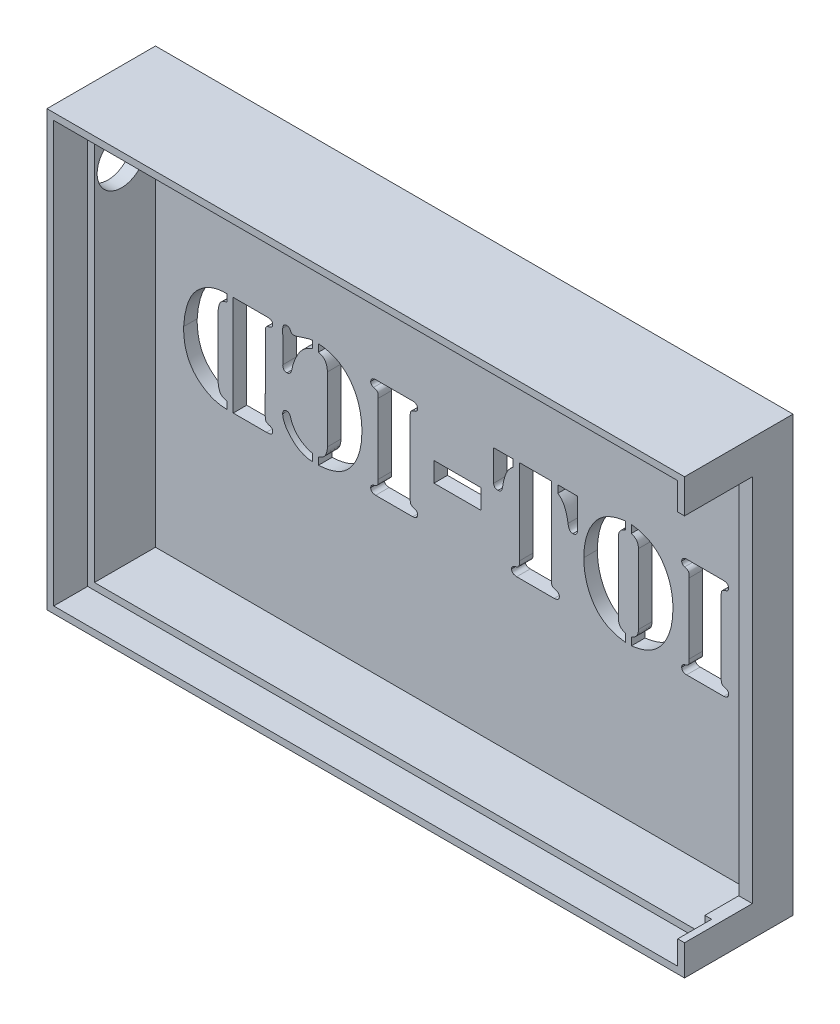
from build123d import *

# Parameters (mm, degrees)
SKETCH1_W           = 94
SKETCH1_H           = 64
BOSS_EXTRUDE1_DEPTH = 16
SKETCH2_W           = 90
SKETCH2_H           = 60
CUT_EXTRUDE1_DEPTH  = 14
SKETCH4_W           = 92
SKETCH4_H           = 62
CUT_EXTRUDE2_DEPTH  = 5
CUT_EXTRUDE4_REACH  = 100.712
SKETCH8_W           = 10
SKETCH8_H           = 54.5
CUT_EXTRUDE3_REACH  = 102.578
SKETCH5_R           = 3.6
CUT_EXTRUDE5_REACH  = 61.068
SKETCH9_W           = 6.905440825
SKETCH9_H           = 2.900056573


with BuildPart() as part:
    # Sketch1 → Boss-Extrude1 (new body)
    with BuildSketch(Plane.XY):
        Rectangle(SKETCH1_W, SKETCH1_H)
    extrude(amount=BOSS_EXTRUDE1_DEPTH)

    # Sketch2 → Cut-Extrude1 (cut)
    with BuildSketch(Plane.XY.offset(16)):
        Rectangle(SKETCH2_W, SKETCH2_H)
    extrude(amount=-CUT_EXTRUDE1_DEPTH, mode=Mode.SUBTRACT)

    # Sketch4 → Cut-Extrude2 (cut)
    with BuildSketch(Plane.XY.offset(16)):
        Rectangle(SKETCH4_W, SKETCH4_H)
    extrude(amount=-CUT_EXTRUDE2_DEPTH, mode=Mode.SUBTRACT)

    # Sketch8 → Cut-Extrude4 (cut, up to next)
    with BuildSketch(Plane.ZY.offset(-45), mode=Mode.PRIVATE) as cut_extrude4_sk1:
        with Locations((11, -0.25)):
            Rectangle(SKETCH8_W, SKETCH8_H)
    cut_extrude4_tool1 = extrude(cut_extrude4_sk1.sketch, amount=-CUT_EXTRUDE4_REACH, mode=Mode.PRIVATE) & part.part
    add(cut_extrude4_tool1.solids().sort_by_distance((45, -0.25, 11))[0], mode=Mode.SUBTRACT)

    # Sketch5 → Cut-Extrude3 (cut, up to next)
    with BuildSketch(Plane.ZY.offset(47), mode=Mode.PRIVATE) as cut_extrude3_sk1:
        with Locations(Location((7, 22, 0), (0, 0, 270))):
            Circle(SKETCH5_R)
    cut_extrude3_tool1 = extrude(cut_extrude3_sk1.sketch, amount=-CUT_EXTRUDE3_REACH, mode=Mode.PRIVATE) & part.part
    add(cut_extrude3_tool1.solids().sort_by_distance((-47, 22, 7))[0], mode=Mode.SUBTRACT)

    # Sketch9 → Cut-Extrude5 (cut, up to next)
    with BuildSketch(Plane(origin=(0, 0, 0), x_dir=(-1, 0, 0), z_dir=(0, 0, -1)), mode=Mode.PRIVATE) as cut_extrude5_sk1:
        with BuildLine():
            add(Edge.make_bspline(
                [(-33.683356234, 5.424940951), (-33.685383923, 5.505725735), (-33.689109282, 5.654147066), (-33.679329223, 5.856839376), (-33.654562528, 6.018511172), (-33.617313459, 6.152096153), (-33.532050425, 6.259802906), (-33.400211127, 6.345497218), (-33.223226692, 6.424281904), (-33.087371388, 6.466297322), (-33.012575432, 6.489429163)],
                knots=[0, 0, 0, 0, 1.350869333, 2.481876085, 3.383954417, 4.08807454, 4.76881483, 5.624852681, 6.692348342, 8, 8, 8, 8], degree=3))
            add(Edge.make_bspline(
                [(-33.012575432, 6.489429163), (-32.950624617, 6.511273117), (-32.832301557, 6.552994011), (-32.69150057, 6.675475128), (-32.602812455, 6.837939374), (-32.587025716, 6.95927533), (-32.578708701, 7.023199418)],
                knots=[0, 0, 0, 0, 1.060220224, 2.024969317, 2.959483743, 4, 4, 4, 4], degree=3))
            add(Edge.make_bspline(
                [(-32.578708701, 7.023199418), (-32.588331485, 7.086582018), (-32.606088084, 7.203539794), (-32.671484927, 7.361960272), (-32.779075568, 7.478000837), (-32.911907786, 7.549378825), (-33.042111418, 7.588828185), (-33.153246146, 7.619243668), (-33.239467505, 7.636121162), (-33.28941481, 7.63463407), (-33.309431617, 7.634038105)],
                knots=[0, 0, 0, 0, 1.445331511, 2.667021546, 3.807406827, 4.942720547, 6.02984224, 6.874113154, 7.54879129, 8, 8, 8, 8], degree=3))
            Line((-33.309431617, 7.634038105), (-38.785089672, 7.636889704))
            add(Edge.make_bspline(
                [(-38.785089672, 7.636889704), (-38.805748379, 7.636404364), (-38.855372194, 7.635238539), (-38.942065629, 7.618897384), (-39.05357218, 7.589349434), (-39.184283266, 7.549140811), (-39.317609156, 7.478986859), (-39.42125767, 7.360178808), (-39.49140611, 7.204523701), (-39.50849286, 7.086790999), (-39.517722016, 7.023199418)],
                knots=[0, 0, 0, 0, 0.465561524, 1.118314862, 1.982426278, 3.068347243, 4.202407008, 5.327085789, 6.556264861, 8, 8, 8, 8], degree=3))
            add(Edge.make_bspline(
                [(-39.517722016, 7.023199418), (-39.509708452, 6.959081672), (-39.494439763, 6.836914576), (-39.401589097, 6.677321562), (-39.264205644, 6.552013812), (-39.146066334, 6.511017458), (-39.083855285, 6.489429163)],
                knots=[0, 0, 0, 0, 1.041578527, 1.984577334, 2.938697389, 4, 4, 4, 4], degree=3))
            add(Edge.make_bspline(
                [(-39.083855285, 6.489429163), (-39.009062484, 6.466296849), (-38.873212911, 6.424280573), (-38.69619379, 6.345501084), (-38.564449931, 6.259792471), (-38.478911564, 6.152126975), (-38.442725619, 6.018220827), (-38.412153795, 5.857307439), (-38.408980762, 5.653899225), (-38.411630989, 5.505546168), (-38.413074483, 5.424743039)],
                knots=[0, 0, 0, 0, 1.307164805, 2.374263026, 3.229982166, 3.910469009, 4.614326981, 5.518728441, 6.648531347, 8, 8, 8, 8], degree=3))
            Line((-38.413074483, 5.424743039), (-38.410222884, -4.9251756))
            add(Edge.make_bspline(
                [(-38.410222884, -4.9251756), (-38.409974303, -5.006014654), (-38.409517971, -5.154414281), (-38.412324422, -5.358719312), (-38.442393277, -5.520699712), (-38.478930774, -5.655495476), (-38.564443428, -5.763167475), (-38.696196199, -5.848873834), (-38.873212081, -5.927654142), (-39.00906219, -5.969670283), (-39.083855285, -5.992802522)],
                knots=[0, 0, 0, 0, 1.349150888, 2.476692652, 3.394907945, 4.097357245, 4.776482189, 5.630488727, 6.695451301, 8, 8, 8, 8], degree=3))
            add(Edge.make_bspline(
                [(-39.083855285, -5.992802522), (-39.146066334, -6.014390817), (-39.264205644, -6.055387171), (-39.401589097, -6.180694921), (-39.494439763, -6.340287935), (-39.509708452, -6.462455032), (-39.517722016, -6.526572777)],
                knots=[0, 0, 0, 0, 1.061302611, 2.015422666, 2.958421473, 4, 4, 4, 4], degree=3))
            add(Edge.make_bspline(
                [(-39.517722016, -6.526572777), (-39.508507324, -6.590189752), (-39.491447351, -6.707969467), (-39.42112565, -6.863320379), (-39.31836877, -6.982796559), (-39.183501576, -7.049225361), (-39.053177682, -7.089525267), (-38.942046906, -7.121053427), (-38.856305033, -7.142978041), (-38.807047895, -7.141050433), (-38.7869991, -7.140265851)],
                knots=[0, 0, 0, 0, 1.446593523, 2.678206188, 3.805111669, 4.93099073, 6.019061659, 6.89047419, 7.548397311, 8, 8, 8, 8], degree=3))
            Line((-38.7869991, -7.140265851), (-33.308489447, -7.137414252))
            add(Edge.make_bspline(
                [(-33.308489447, -7.137414252), (-33.288771553, -7.139280102), (-33.238967788, -7.143992895), (-33.153193151, -7.121495244), (-33.042545717, -7.088962406), (-32.912680156, -7.049475791), (-32.778304333, -6.981824578), (-32.671614794, -6.865104306), (-32.606047493, -6.706984829), (-32.588317219, -6.589980568), (-32.578708701, -6.526572777)],
                knots=[0, 0, 0, 0, 0.445053134, 1.124122192, 1.974914459, 3.063058393, 4.189012996, 5.330470602, 6.553309416, 8, 8, 8, 8], degree=3))
            add(Edge.make_bspline(
                [(-32.578708701, -6.526572777), (-32.587025716, -6.46264869), (-32.602812455, -6.341312734), (-32.69150057, -6.178848487), (-32.832301557, -6.056367371), (-32.950624617, -6.014646476), (-33.012575432, -5.992802522)],
                knots=[0, 0, 0, 0, 1.040516257, 1.975030683, 2.939779776, 4, 4, 4, 4], degree=3))
            add(Edge.make_bspline(
                [(-33.012575432, -5.992802522), (-33.0873717, -5.969670737), (-33.22322757, -5.927655421), (-33.400208578, -5.848870119), (-33.532057305, -5.763177502), (-33.617293136, -5.65546586), (-33.654907972, -5.520983194), (-33.679038101, -5.358261216), (-33.689192829, -5.154612663), (-33.685413865, -5.006117199), (-33.683356234, -4.925262012)],
                knots=[0, 0, 0, 0, 1.304909864, 2.370167273, 3.224410244, 3.903723205, 4.606366977, 5.52222738, 6.650862715, 8, 8, 8, 8], degree=3))
            Line((-33.683356234, -4.925262012), (-33.683356234, 5.424940951))
        make_face()
    cut_extrude5_tool1 = extrude(cut_extrude5_sk1.sketch, amount=-CUT_EXTRUDE5_REACH, mode=Mode.PRIVATE) & part.part
    # Sketch9 → Cut-Extrude5 (cut, up to next)
    with BuildSketch(Plane(origin=(0, 0, 0), x_dir=(-1, 0, 0), z_dir=(0, 0, -1)), mode=Mode.PRIVATE) as cut_extrude5_sk2:
        with BuildLine():
            add(Edge.make_bspline(
                [(-25.171445006, 8.002251162), (-25.4245338, 7.967174383), (-25.916885152, 7.898937069), (-26.624094209, 7.717480715), (-27.282058333, 7.489181382), (-27.890857861, 7.20207221), (-28.447701286, 6.856690012), (-28.950038036, 6.448447392), (-29.40837194, 5.991922503), (-29.80575666, 5.474272736), (-30.153592705, 4.917980675), (-30.461929448, 4.334221535), (-30.718231578, 3.720251744), (-30.930549841, 3.079363444), (-31.092828791, 2.410021658), (-31.205663865, 1.713339029), (-31.275930709, 0.990476195), (-31.284284528, 0.499185768), (-31.288526053, 0.249740514)],
                knots=[0, 0, 0, 0, 1.118512111, 2.175919922, 3.192287028, 4.165519079, 5.11851233, 6.055224113, 6.995406943, 7.945872029, 8.90682575, 9.866974632, 10.834612295, 11.81788704, 12.821733316, 13.848203452, 14.907457978, 16, 16, 16, 16], degree=3))
            add(Edge.make_bspline(
                [(-31.288526053, 0.249740514), (-31.284317103, -0.000658649), (-31.276042945, -0.492905605), (-31.20559637, -1.216697789), (-31.09321653, -1.912534526), (-30.93015581, -2.580755167), (-30.717611972, -3.221450898), (-30.462670982, -3.836958859), (-30.153504753, -4.421317484), (-29.805778117, -4.977652052), (-29.408373038, -5.495307955), (-28.950012886, -5.951767242), (-28.447801179, -6.360266212), (-27.890123852, -6.704881768), (-27.282806437, -6.995920855), (-26.624425521, -7.224310348), (-25.916486597, -7.40142352), (-25.424548982, -7.470239516), (-25.171576018, -7.505627309)],
                knots=[0, 0, 0, 0, 1.096396122, 2.155349275, 3.181527364, 4.181040018, 5.164035006, 6.135239723, 7.095115428, 8.055795743, 9.005990407, 9.94590574, 10.882351015, 11.835073125, 12.809820101, 13.825898034, 14.881994382, 16, 16, 16, 16], degree=3))
            Line((-25.171576018, -7.505627309), (-25.171445006, -6.346804972))
            add(Edge.make_bspline(
                [(-25.171445006, -6.346804972), (-25.276888727, -6.304538058), (-25.472671906, -6.226058745), (-25.722808998, -6.066294147), (-25.915341368, -5.893193137), (-26.04130771, -5.698293098), (-26.115499676, -5.498324412), (-26.171597042, -5.304002795), (-26.198815056, -5.107729798), (-26.195239416, -4.978599317), (-26.193446346, -4.913844467)],
                knots=[0, 0, 0, 0, 1.423802981, 2.643653609, 3.708841539, 4.650130248, 5.524410317, 6.379618295, 7.187429841, 8, 8, 8, 8], degree=3))
            Line((-26.193446346, -4.913844467), (-26.193446346, 5.412207712))
            add(Edge.make_bspline(
                [(-26.193446346, 5.412207712), (-26.195136498, 5.476369987), (-26.198546932, 5.605838369), (-26.172364012, 5.801753826), (-26.114902338, 5.995739011), (-26.041391823, 6.194947253), (-25.915303969, 6.389786734), (-25.722870573, 6.563042315), (-25.472135309, 6.722314829), (-25.276880189, 6.802813342), (-25.171576018, 6.846227462)],
                knots=[0, 0, 0, 0, 0.805570241, 1.625501514, 2.46947775, 3.344051139, 4.285655649, 5.351200949, 6.571460835, 8, 8, 8, 8], degree=3))
            Line((-25.171576018, 6.846227462), (-25.171445006, 8.002251162))
        make_face()
    cut_extrude5_tool2 = extrude(cut_extrude5_sk2.sketch, amount=-CUT_EXTRUDE5_REACH, mode=Mode.PRIVATE) & part.part
    # Sketch9 → Cut-Extrude5 (cut, up to next)
    with BuildSketch(Plane(origin=(0, 0, 0), x_dir=(-1, 0, 0), z_dir=(0, 0, -1)), mode=Mode.PRIVATE) as cut_extrude5_sk3:
        with BuildLine():
            add(Edge.make_bspline(
                [(-24.269679118, -7.50277571), (-24.017634285, -7.468400077), (-23.525595101, -7.40129234), (-22.818319497, -7.225260413), (-22.160553766, -6.995183691), (-21.553708791, -6.705147697), (-20.996175366, -6.359167165), (-20.491263613, -5.953747866), (-20.035861219, -5.49413005), (-19.638066781, -4.97782941), (-19.290583564, -4.421265037), (-18.981252958, -3.836990922), (-18.726731059, -3.221374317), (-18.51271875, -2.581247291), (-18.355533949, -1.911752296), (-18.237299718, -1.217091068), (-18.167593318, -0.492889637), (-18.161465584, -0.00064443), (-18.158348657, 0.249740514)],
                knots=[0, 0, 0, 0, 1.113693922, 2.174141171, 3.186581958, 4.161610316, 5.11460745, 6.054572347, 6.991825646, 7.942294605, 8.903252241, 9.863405036, 10.834890113, 11.818168865, 12.816987803, 13.844147349, 14.903406192, 16, 16, 16, 16], degree=3))
            add(Edge.make_bspline(
                [(-18.158348657, 0.249740514), (-18.161497792, 0.499171747), (-18.167700448, 0.990460962), (-18.237235005, 1.71373158), (-18.355922661, 2.409241412), (-18.512327072, 3.079853078), (-18.726108737, 3.720176067), (-18.981995032, 4.334253357), (-19.290495525, 4.917928264), (-19.638088261, 5.474450082), (-20.035862328, 5.990744618), (-20.491238505, 6.450427875), (-20.996275723, 6.855590276), (-21.552975056, 7.202336997), (-22.161299592, 7.488452258), (-22.8186497, 7.718419181), (-23.526031611, 7.899089944), (-24.019396575, 7.965392744), (-24.272444305, 7.999399563)],
                knots=[0, 0, 0, 0, 1.092478599, 2.151787272, 3.17899514, 4.181914403, 5.165239412, 6.132926538, 7.093124502, 8.054127344, 9.004641017, 9.941938407, 10.881947523, 11.834989489, 12.80827129, 13.820759706, 14.882263942, 16, 16, 16, 16], degree=3))
            Line((-24.272444305, 7.999399563), (-24.269679118, 6.84720587))
            add(Edge.make_bspline(
                [(-24.269679118, 6.84720587), (-24.165390995, 6.803260233), (-23.971464095, 6.721542001), (-23.721111417, 6.56312735), (-23.528724972, 6.389767986), (-23.402625953, 6.194951653), (-23.329120426, 5.995737868), (-23.271649262, 5.801754276), (-23.245421281, 5.60526072), (-23.24886139, 5.475212782), (-23.250573977, 5.410471107)],
                knots=[0, 0, 0, 0, 1.419963781, 2.640465328, 3.706221647, 4.648012632, 5.522759221, 6.366902598, 7.18699625, 8, 8, 8, 8], degree=3))
            Line((-23.250573977, 5.410471107), (-23.247725166, -4.911806814))
            add(Edge.make_bspline(
                [(-23.247725166, -4.911806814), (-23.247109723, -4.977239853), (-23.24588886, -5.107040149), (-23.272202635, -5.304004986), (-23.328583165, -5.498322346), (-23.402691795, -5.698299399), (-23.528696392, -5.893166784), (-23.721156227, -6.066413504), (-23.971882962, -6.225688876), (-24.167139416, -6.306186942), (-24.272444305, -6.349600821)],
                knots=[0, 0, 0, 0, 0.819867786, 1.626381442, 2.480215379, 3.353090765, 4.292867129, 5.356343649, 6.574234375, 8, 8, 8, 8], degree=3))
            Line((-24.272444305, -6.349600821), (-24.269679118, -7.50277571))
        make_face()
    cut_extrude5_tool3 = extrude(cut_extrude5_sk3.sketch, amount=-CUT_EXTRUDE5_REACH, mode=Mode.PRIVATE) & part.part
    # Sketch9 → Cut-Extrude5 (cut, up to next)
    with BuildSketch(Plane(origin=(0, 0, 0), x_dir=(-1, 0, 0), z_dir=(0, 0, -1)), mode=Mode.PRIVATE) as cut_extrude5_sk4:
        with BuildLine():
            add(Edge.make_bspline(
                [(-13.382963013, -4.913624255), (-13.380518468, -4.995531163), (-13.376052704, -5.145161025), (-13.390380459, -5.349747716), (-13.415757298, -5.513360002), (-13.460978426, -5.647709273), (-13.552151464, -5.75463397), (-13.691173613, -5.841039513), (-13.878604648, -5.923280232), (-14.024493583, -5.964379816), (-14.105119982, -5.987093749)],
                knots=[0, 0, 0, 0, 1.327678846, 2.425441354, 3.317993041, 4.01118176, 4.690505303, 5.546043787, 6.643806295, 8, 8, 8, 8], degree=3))
            add(Edge.make_bspline(
                [(-14.105119982, -5.987093749), (-14.169894306, -6.008803386), (-14.292704153, -6.049964096), (-14.439897773, -6.171917749), (-14.533056781, -6.335731241), (-14.548141536, -6.458723482), (-14.556113032, -6.523718391)],
                knots=[0, 0, 0, 0, 1.079008359, 2.045762032, 2.967288359, 4, 4, 4, 4], degree=3))
            add(Edge.make_bspline(
                [(-14.556113032, -6.523718391), (-14.546931402, -6.58732181), (-14.529751233, -6.706333083), (-14.457455683, -6.864078916), (-14.347047197, -6.984004455), (-14.205231636, -7.048592171), (-14.0688114, -7.089860566), (-13.952746542, -7.120824873), (-13.862342947, -7.143188174), (-13.81024081, -7.141132279), (-13.788283093, -7.140265851)],
                knots=[0, 0, 0, 0, 1.400838523, 2.621173137, 3.740682438, 4.886230319, 5.979477563, 6.863485528, 7.521031866, 8, 8, 8, 8], degree=3))
            Line((-13.788283093, -7.140265851), (-8.25358607, -7.137414252))
            add(Edge.make_bspline(
                [(-8.25358607, -7.137414252), (-8.231646915, -7.139446172), (-8.179598056, -7.144266738), (-8.089154663, -7.120376311), (-7.973103279, -7.09003062), (-7.836678202, -7.048539942), (-7.69486408, -6.984018314), (-7.584455205, -6.864074903), (-7.512159769, -6.706334302), (-7.494979583, -6.587322235), (-7.485797943, -6.523718391)],
                knots=[0, 0, 0, 0, 0.479106192, 1.13664046, 2.020632198, 3.113859374, 4.259386227, 5.378874978, 6.599187191, 8, 8, 8, 8], degree=3))
            add(Edge.make_bspline(
                [(-7.485797943, -6.523718391), (-7.492280813, -6.458481963), (-7.504611675, -6.334397808), (-7.602628882, -6.173843514), (-7.746874698, -6.048218876), (-7.870707885, -6.008362795), (-7.936790993, -5.987093749)],
                knots=[0, 0, 0, 0, 1.028076699, 1.95547232, 2.908945604, 4, 4, 4, 4], degree=3))
            add(Edge.make_bspline(
                [(-7.936790993, -5.987093749), (-8.017473053, -5.964464741), (-8.163462701, -5.923518822), (-8.351016696, -5.840037927), (-8.492280369, -5.755560232), (-8.583771727, -5.647635789), (-8.628877657, -5.513377513), (-8.655173529, -5.349848356), (-8.664626605, -5.145099635), (-8.660958598, -4.995651575), (-8.65895075, -4.913844467)],
                knots=[0, 0, 0, 0, 1.354387758, 2.450688454, 3.317903348, 3.996322285, 4.688587933, 5.579951073, 6.675277519, 8, 8, 8, 8], degree=3))
            Line((-8.65895075, -4.913844467), (-8.656099151, 7.636889704))
            Line((-8.656099151, 7.636889704), (-13.382963013, 7.636889704))
            Line((-13.382963013, 7.636889704), (-13.382963013, -4.913624255))
        make_face()
    cut_extrude5_tool4 = extrude(cut_extrude5_sk4.sketch, amount=-CUT_EXTRUDE5_REACH, mode=Mode.PRIVATE) & part.part
    # Sketch9 → Cut-Extrude5 (cut, up to next)
    with BuildSketch(Plane(origin=(0, 0, 0), x_dir=(-1, 0, 0), z_dir=(0, 0, -1)), mode=Mode.PRIVATE) as cut_extrude5_sk5:
        with BuildLine():
            Line((-4.83693016, 7.636889704), (-7.702736884, 7.636889704))
            Line((-7.702736884, 7.636889704), (-7.702736884, 6.563637634))
            add(Edge.make_bspline(
                [(-7.702736884, 6.563637634), (-7.583674921, 6.46401308), (-7.349607173, 6.268157961), (-7.052667727, 5.922593568), (-6.809721667, 5.544452593), (-6.632677299, 5.132740829), (-6.489277946, 4.71318379), (-6.373764455, 4.292987635), (-6.276317994, 3.878377137), (-6.233802866, 3.601125309), (-6.212741613, 3.463779589)],
                knots=[0, 0, 0, 0, 1.053496182, 2.071102086, 3.082733532, 4.095707145, 5.107855021, 6.094591896, 7.056094062, 8, 8, 8, 8], degree=3))
            add(Edge.make_bspline(
                [(-6.212741613, 3.463779589), (-6.19628142, 3.352701258), (-6.163740278, 3.133103854), (-6.072790022, 2.872784453), (-5.959846051, 2.690275653), (-5.834630132, 2.590169267), (-5.67517077, 2.529576348), (-5.558686485, 2.517098439), (-5.496290629, 2.510414535)],
                knots=[0, 0, 0, 0, 1.524550261, 3.013974697, 3.713404531, 4.412236306, 5.149500086, 6, 6, 6, 6], degree=3))
            add(Edge.make_bspline(
                [(-5.496290629, 2.510414535), (-5.430134701, 2.516247782), (-5.307757044, 2.527038338), (-5.145868396, 2.580656725), (-5.018989341, 2.658714627), (-4.940828651, 2.764598465), (-4.893196505, 2.868578698), (-4.858647527, 2.955989967), (-4.836761677, 3.026998746), (-4.838867146, 3.068829407), (-4.839781759, 3.087000586)],
                knots=[0, 0, 0, 0, 1.629875838, 3.015003954, 4.164879003, 5.233131204, 6.196895001, 6.9755109, 7.554963399, 8, 8, 8, 8], degree=3))
            Line((-4.839781759, 3.087000586), (-4.83693016, 7.636889704))
        make_face()
    cut_extrude5_tool5 = extrude(cut_extrude5_sk5.sketch, amount=-CUT_EXTRUDE5_REACH, mode=Mode.PRIVATE) & part.part
    # Sketch9 → Cut-Extrude5 (cut, up to next)
    with BuildSketch(Plane(origin=(0, 0, 0), x_dir=(-1, 0, 0), z_dir=(0, 0, -1)), mode=Mode.PRIVATE) as cut_extrude5_sk6:
        with BuildLine():
            add(Edge.make_bspline(
                [(-17.202132004, 3.088048681), (-17.204441607, 3.069477612), (-17.209728587, 3.026966039), (-17.181611232, 2.956578385), (-17.149382801, 2.868425632), (-17.100812974, 2.764736599), (-17.022744282, 2.657639467), (-16.894235976, 2.582230079), (-16.73353602, 2.526315317), (-16.611875549, 2.516020824), (-16.545620346, 2.510414535)],
                knots=[0, 0, 0, 0, 0.453514809, 1.038153964, 1.815526206, 2.777750613, 3.84429653, 5.011936704, 6.372727511, 8, 8, 8, 8], degree=3))
            add(Edge.make_bspline(
                [(-16.545620346, 2.510414535), (-16.483224491, 2.517098439), (-16.366740206, 2.529576348), (-16.207280843, 2.590169267), (-16.082064924, 2.690275653), (-15.969120954, 2.872784453), (-15.878170698, 3.133103854), (-15.845629556, 3.352701258), (-15.829169362, 3.463779589)],
                knots=[0, 0, 0, 0, 0.850499914, 1.587763694, 2.286595469, 2.986025303, 4.475449739, 6, 6, 6, 6], degree=3))
            add(Edge.make_bspline(
                [(-15.829169362, 3.463779589), (-15.808108178, 3.601125387), (-15.765593189, 3.878377373), (-15.668145664, 4.292986659), (-15.552636368, 4.713187595), (-15.409220862, 5.132726222), (-15.232237106, 5.544507077), (-14.9890647, 5.922390042), (-14.692927515, 6.269000729), (-14.456580116, 6.462390872), (-14.33632528, 6.560788823)],
                knots=[0, 0, 0, 0, 0.94383586, 1.905266641, 2.891930258, 3.904002989, 4.916901396, 5.928457736, 6.94598809, 8, 8, 8, 8], degree=3))
            Line((-14.33632528, 6.560788823), (-14.33632528, 7.636889704))
            Line((-14.33632528, 7.636889704), (-17.202132004, 7.636889704))
            Line((-17.202132004, 7.636889704), (-17.202132004, 3.088048681))
        make_face()
    cut_extrude5_tool6 = extrude(cut_extrude5_sk6.sketch, amount=-CUT_EXTRUDE5_REACH, mode=Mode.PRIVATE) & part.part
    # Sketch9 → Cut-Extrude5 (cut, up to next)
    with BuildSketch(Plane(origin=(0, 0, 0), x_dir=(-1, 0, 0), z_dir=(0, 0, -1)), mode=Mode.PRIVATE) as cut_extrude5_sk7:
        with Locations((0.489354844, 0.158397362)):
            Rectangle(SKETCH9_W, SKETCH9_H)
    cut_extrude5_tool7 = extrude(cut_extrude5_sk7.sketch, amount=-CUT_EXTRUDE5_REACH, mode=Mode.PRIVATE) & part.part
    # Sketch9 → Cut-Extrude5 (cut, up to next)
    with BuildSketch(Plane(origin=(0, 0, 0), x_dir=(-1, 0, 0), z_dir=(0, 0, -1)), mode=Mode.PRIVATE) as cut_extrude5_sk8:
        with BuildLine():
            add(Edge.make_bspline(
                [(12.169506741, 5.424940951), (12.167479052, 5.505725735), (12.163753693, 5.654147066), (12.173533752, 5.856839376), (12.198300447, 6.018511172), (12.235549516, 6.152096153), (12.32081255, 6.259802906), (12.452651848, 6.345497218), (12.629636283, 6.424281904), (12.765491587, 6.466297322), (12.840287543, 6.489429163)],
                knots=[0, 0, 0, 0, 1.350869333, 2.481876085, 3.383954417, 4.08807454, 4.76881483, 5.624852681, 6.692348342, 8, 8, 8, 8], degree=3))
            add(Edge.make_bspline(
                [(12.840287543, 6.489429163), (12.902238358, 6.511273117), (13.020561418, 6.552994011), (13.161362405, 6.675475128), (13.25005052, 6.837939374), (13.265837259, 6.95927533), (13.274154274, 7.023199418)],
                knots=[0, 0, 0, 0, 1.060220224, 2.024969317, 2.959483743, 4, 4, 4, 4], degree=3))
            add(Edge.make_bspline(
                [(13.274154274, 7.023199418), (13.26453149, 7.086582018), (13.246774891, 7.203539794), (13.181378048, 7.361960272), (13.073787407, 7.478000837), (12.940955189, 7.549378825), (12.810751558, 7.588828185), (12.699616829, 7.619243668), (12.61339547, 7.636121162), (12.563448165, 7.63463407), (12.543431358, 7.634038105)],
                knots=[0, 0, 0, 0, 1.445331511, 2.667021546, 3.807406827, 4.942720547, 6.02984224, 6.874113154, 7.54879129, 8, 8, 8, 8], degree=3))
            Line((12.543431358, 7.634038105), (7.067773303, 7.636889704))
            add(Edge.make_bspline(
                [(7.067773303, 7.636889704), (7.047114596, 7.636404364), (6.997490781, 7.635238539), (6.910797346, 7.618897384), (6.799290796, 7.589349434), (6.668579709, 7.549140811), (6.535253819, 7.478986859), (6.431605305, 7.360178808), (6.361456865, 7.204523701), (6.344370115, 7.086790999), (6.335140959, 7.023199418)],
                knots=[0, 0, 0, 0, 0.465561524, 1.118314862, 1.982426278, 3.068347243, 4.202407008, 5.327085789, 6.556264861, 8, 8, 8, 8], degree=3))
            add(Edge.make_bspline(
                [(6.335140959, 7.023199418), (6.343154523, 6.959081672), (6.358423212, 6.836914576), (6.451273878, 6.677321562), (6.588657331, 6.552013812), (6.706796641, 6.511017458), (6.76900769, 6.489429163)],
                knots=[0, 0, 0, 0, 1.041578527, 1.984577334, 2.938697389, 4, 4, 4, 4], degree=3))
            add(Edge.make_bspline(
                [(6.76900769, 6.489429163), (6.843800491, 6.466296849), (6.979650064, 6.424280573), (7.156669185, 6.345501084), (7.288413044, 6.259792471), (7.373951411, 6.152126975), (7.410137356, 6.018220827), (7.44070918, 5.857307439), (7.443882213, 5.653899225), (7.441231986, 5.505546168), (7.439788492, 5.424743039)],
                knots=[0, 0, 0, 0, 1.307164805, 2.374263026, 3.229982166, 3.910469009, 4.614326981, 5.518728441, 6.648531347, 8, 8, 8, 8], degree=3))
            Line((7.439788492, 5.424743039), (7.442640091, -4.9251756))
            add(Edge.make_bspline(
                [(7.442640091, -4.9251756), (7.442888672, -5.006014654), (7.443345004, -5.154414281), (7.440538553, -5.358719312), (7.410469699, -5.520699712), (7.373932201, -5.655495476), (7.288419547, -5.763167475), (7.156666776, -5.848873834), (6.979650894, -5.927654142), (6.843800786, -5.969670283), (6.76900769, -5.992802522)],
                knots=[0, 0, 0, 0, 1.349150888, 2.476692652, 3.394907945, 4.097357245, 4.776482189, 5.630488727, 6.695451301, 8, 8, 8, 8], degree=3))
            add(Edge.make_bspline(
                [(6.76900769, -5.992802522), (6.706796641, -6.014390817), (6.588657331, -6.055387171), (6.451273878, -6.180694921), (6.358423212, -6.340287935), (6.343154523, -6.462455032), (6.335140959, -6.526572777)],
                knots=[0, 0, 0, 0, 1.061302611, 2.015422666, 2.958421473, 4, 4, 4, 4], degree=3))
            add(Edge.make_bspline(
                [(6.335140959, -6.526572777), (6.344355651, -6.590189752), (6.361415624, -6.707969467), (6.431737325, -6.863320379), (6.534494205, -6.982796559), (6.6693614, -7.049225361), (6.799685294, -7.089525267), (6.910816069, -7.121053427), (6.996557943, -7.142978041), (7.04581508, -7.141050433), (7.065863875, -7.140265851)],
                knots=[0, 0, 0, 0, 1.446593523, 2.678206188, 3.805111669, 4.93099073, 6.019061659, 6.89047419, 7.548397311, 8, 8, 8, 8], degree=3))
            Line((7.065863875, -7.140265851), (12.544373529, -7.137414252))
            add(Edge.make_bspline(
                [(12.544373529, -7.137414252), (12.564091422, -7.139280102), (12.613895188, -7.143992895), (12.699669824, -7.121495244), (12.810317259, -7.088962406), (12.940182819, -7.049475791), (13.074558643, -6.981824578), (13.181248181, -6.865104306), (13.246815482, -6.706984829), (13.264545756, -6.589980568), (13.274154274, -6.526572777)],
                knots=[0, 0, 0, 0, 0.445053134, 1.124122192, 1.974914459, 3.063058393, 4.189012996, 5.330470602, 6.553309416, 8, 8, 8, 8], degree=3))
            add(Edge.make_bspline(
                [(13.274154274, -6.526572777), (13.265837259, -6.46264869), (13.25005052, -6.341312734), (13.161362405, -6.178848487), (13.020561418, -6.056367371), (12.902238358, -6.014646476), (12.840287543, -5.992802522)],
                knots=[0, 0, 0, 0, 1.040516257, 1.975030683, 2.939779776, 4, 4, 4, 4], degree=3))
            add(Edge.make_bspline(
                [(12.840287543, -5.992802522), (12.765491275, -5.969670737), (12.629635405, -5.927655421), (12.452654397, -5.848870119), (12.32080567, -5.763177502), (12.23556984, -5.65546586), (12.197955004, -5.520983194), (12.173824874, -5.358261216), (12.163670146, -5.154612663), (12.16744911, -5.006117199), (12.169506741, -4.925262012)],
                knots=[0, 0, 0, 0, 1.304909864, 2.370167273, 3.224410244, 3.903723205, 4.606366977, 5.52222738, 6.650862715, 8, 8, 8, 8], degree=3))
            Line((12.169506741, -4.925262012), (12.169506741, 5.424940951))
        make_face()
    cut_extrude5_tool8 = extrude(cut_extrude5_sk8.sketch, amount=-CUT_EXTRUDE5_REACH, mode=Mode.PRIVATE) & part.part
    # Sketch9 → Cut-Extrude5 (cut, up to next)
    with BuildSketch(Plane(origin=(0, 0, 0), x_dir=(-1, 0, 0), z_dir=(0, 0, -1)), mode=Mode.PRIVATE) as cut_extrude5_sk9:
        with BuildLine():
            add(Edge.make_bspline(
                [(21.874417681, 6.928999092), (21.982678104, 6.888931756), (22.197147384, 6.809556372), (22.503888436, 6.659678819), (22.793288219, 6.486079369), (23.061591629, 6.28481985), (23.313341544, 6.061624764), (23.540001271, 5.807999879), (23.753729376, 5.534097268), (24.003457807, 5.134226342), (24.277749995, 4.616288621), (24.549556815, 3.980097246), (24.766016252, 3.340378681), (24.857613817, 2.905408023), (24.902924429, 2.690240877)],
                knots=[0, 0, 0, 0, 0.760099498, 1.505794897, 2.245379778, 2.980007565, 3.712412489, 4.457870753, 5.217632931, 5.99835976, 7.560228535, 9.073807233, 10.552498808, 12, 12, 12, 12], degree=3))
            add(Edge.make_bspline(
                [(24.902924429, 2.690240877), (24.928128737, 2.597395964), (24.977459266, 2.415677475), (25.099429405, 2.212367185), (25.230579601, 2.087831733), (25.344449906, 2.016907116), (25.475604797, 1.97333019), (25.56862171, 1.966097065), (25.616521026, 1.962372348)],
                knots=[0, 0, 0, 0, 1.561129722, 3.055483843, 3.778016285, 4.486660621, 5.220701698, 6, 6, 6, 6], degree=3))
            add(Edge.make_bspline(
                [(25.616521026, 1.962372348), (25.683832344, 1.970666374), (25.807645068, 1.98592244), (25.971125138, 2.051754479), (26.095328839, 2.151361605), (26.160071615, 2.284889623), (26.193161956, 2.41400817), (26.225119926, 2.525152993), (26.238608141, 2.615796952), (26.234697409, 2.66835081), (26.233068486, 2.690240877)],
                knots=[0, 0, 0, 0, 1.500284965, 2.759630567, 3.868615958, 4.945964911, 5.981926752, 6.832433425, 7.513677735, 8, 8, 8, 8], degree=3))
            Line((26.233068486, 2.690240877), (26.235920085, 7.336072501))
            add(Edge.make_bspline(
                [(26.235920085, 7.336072501), (26.236449351, 7.356441906), (26.237678514, 7.403747707), (26.224853225, 7.486100428), (26.193179651, 7.586788868), (26.160144905, 7.706112211), (26.0927449, 7.828542232), (25.971027973, 7.922332731), (25.805873414, 7.976673063), (25.683526725, 7.991357388), (25.616521026, 7.999399563)],
                knots=[0, 0, 0, 0, 0.474811723, 1.102700339, 1.932131455, 2.936017163, 3.990655112, 5.127809759, 6.426985501, 8, 8, 8, 8], degree=3))
            add(Edge.make_bspline(
                [(25.616521026, 7.999399563), (25.557412718, 7.993886462), (25.444415395, 7.98334707), (25.292836878, 7.901910304), (25.169914255, 7.777414631), (25.122167714, 7.668540151), (25.097022703, 7.611203014)],
                knots=[0, 0, 0, 0, 1.021032341, 1.95190704, 2.921402082, 4, 4, 4, 4], degree=3))
            add(Edge.make_bspline(
                [(25.097022703, 7.611203014), (25.072623743, 7.557781236), (25.025986686, 7.455668914), (24.9053625, 7.33787891), (24.749708531, 7.267694166), (24.635392304, 7.262743288), (24.574669994, 7.260113488)],
                knots=[0, 0, 0, 0, 1.036715905, 1.981616339, 2.927878192, 4, 4, 4, 4], degree=3))
            add(Edge.make_bspline(
                [(24.574669994, 7.260113488), (24.494470322, 7.272062709), (24.314225862, 7.29891794), (24.022666942, 7.377805334), (23.677844254, 7.482122718), (23.301540466, 7.625100525), (22.912811651, 7.76460771), (22.538886226, 7.877109874), (22.195625315, 7.95694079), (21.975548664, 7.985775595), (21.871566082, 7.999399563)],
                knots=[0, 0, 0, 0, 0.692249294, 1.555793163, 2.576581502, 3.769736304, 4.993512227, 6.104592169, 7.104451111, 8, 8, 8, 8], degree=3))
            Line((21.871566082, 7.999399563), (21.874417681, 6.928999092))
        make_face()
    cut_extrude5_tool9 = extrude(cut_extrude5_sk9.sketch, amount=-CUT_EXTRUDE5_REACH, mode=Mode.PRIVATE) & part.part
    # Sketch9 → Cut-Extrude5 (cut, up to next)
    with BuildSketch(Plane(origin=(0, 0, 0), x_dir=(-1, 0, 0), z_dir=(0, 0, -1)), mode=Mode.PRIVATE) as cut_extrude5_sk10:
        with BuildLine():
            add(Edge.make_bspline(
                [(25.039252041, -3.564160127), (24.977355348, -3.747079857), (24.855990941, -4.105741094), (24.58261714, -4.599430787), (24.253241052, -5.046649809), (23.859764034, -5.440187741), (23.418718856, -5.779390435), (22.935266761, -6.056768017), (22.421032533, -6.285350013), (22.05589717, -6.381157299), (21.871566082, -6.42952364)],
                knots=[0, 0, 0, 0, 1.03275405, 2.024980278, 3.008790972, 4.000008487, 4.996102855, 5.980547209, 6.980520738, 8, 8, 8, 8], degree=3))
            Line((21.871566082, -6.42952364), (21.874417681, -7.502772923))
            add(Edge.make_bspline(
                [(21.874417681, -7.502772923), (22.005014066, -7.495815491), (22.265807335, -7.48192191), (22.652534414, -7.415203821), (23.031480014, -7.308020478), (23.403324625, -7.165002605), (23.767885039, -6.984272368), (24.123088354, -6.763034701), (24.468724973, -6.500915246), (24.802635138, -6.208186541), (25.115360837, -5.897088178), (25.392163769, -5.57617297), (25.635916205, -5.256546568), (25.83483769, -4.930055136), (26.00005432, -4.603238092), (26.126033741, -4.274568756), (26.215795621, -3.942700626), (26.240657907, -3.718350764), (26.253049191, -3.6065355)],
                knots=[0, 0, 0, 0, 0.992571692, 1.982107054, 2.97267078, 3.979104614, 5.003483891, 6.05817463, 7.152157741, 8.294127228, 9.428412623, 10.499022638, 11.510630973, 12.477265601, 13.398232924, 14.287942545, 15.14671596, 16, 16, 16, 16], degree=3))
            add(Edge.make_bspline(
                [(26.253049191, -3.6065355), (26.251728487, -3.560715038), (26.249168682, -3.47190526), (26.220071656, -3.344170493), (26.170545233, -3.228954873), (26.10568298, -3.125200319), (26.021679699, -3.03795678), (25.921001673, -2.970930872), (25.802072874, -2.929792428), (25.71770072, -2.922460149), (25.673608754, -2.91862838)],
                knots=[0, 0, 0, 0, 1.093742006, 2.119904087, 3.10832757, 4.079862702, 5.028775843, 5.98122515, 6.945010325, 8, 8, 8, 8], degree=3))
            add(Edge.make_bspline(
                [(25.673608754, -2.91862838), (25.627671718, -2.921492466), (25.54079315, -2.926909178), (25.420772581, -2.963668861), (25.321578493, -3.026314825), (25.21748327, -3.142484281), (25.122837809, -3.326643949), (25.066561208, -3.484093699), (25.037080589, -3.56657409)],
                knots=[0, 0, 0, 0, 0.837237628, 1.583428373, 2.262021896, 2.94942869, 4.401951641, 6, 6, 6, 6], degree=3))
            Line((25.037080589, -3.56657409), (25.039252041, -3.564160127))
        make_face()
    cut_extrude5_tool10 = extrude(cut_extrude5_sk10.sketch, amount=-CUT_EXTRUDE5_REACH, mode=Mode.PRIVATE) & part.part
    # Sketch9 → Cut-Extrude5 (cut, up to next)
    with BuildSketch(Plane(origin=(0, 0, 0), x_dir=(-1, 0, 0), z_dir=(0, 0, -1)), mode=Mode.PRIVATE) as cut_extrude5_sk11:
        with BuildLine():
            add(Edge.make_bspline(
                [(20.959946429, -6.42952364), (20.846185711, -6.393958368), (20.629163767, -6.326110303), (20.343903902, -6.158260572), (20.107453873, -5.954049134), (19.934102174, -5.702334205), (19.807183424, -5.427546946), (19.718617477, -5.136267841), (19.665212176, -4.830207976), (19.661375231, -4.621014846), (19.659416629, -4.514230372)],
                knots=[0, 0, 0, 0, 1.132901948, 2.161243253, 3.131456097, 4.08783245, 5.049527766, 6.007837801, 6.983083276, 8, 8, 8, 8], degree=3))
            Line((19.659416629, -4.514230372), (19.659416629, 5.052109029))
            add(Edge.make_bspline(
                [(19.659416629, 5.052109029), (19.661391972, 5.158462873), (19.665269373, 5.367224993), (19.71867294, 5.67284334), (19.806730888, 5.963354989), (19.933417923, 6.235798829), (20.108024295, 6.482090937), (20.34294847, 6.681220736), (20.629664134, 6.836667646), (20.845196257, 6.895378397), (20.958162437, 6.926150281)],
                knots=[0, 0, 0, 0, 1.02260891, 2.007280552, 2.974853066, 3.937559008, 4.888298327, 5.855827498, 6.876181544, 8, 8, 8, 8], degree=3))
            Line((20.958162437, 6.926150281), (20.959946429, 8.002251162))
            add(Edge.make_bspline(
                [(20.959946429, 8.002251162), (20.721878686, 7.982992202), (20.254711574, 7.945199795), (19.575823713, 7.812452682), (18.935113565, 7.619123011), (18.333455598, 7.359432173), (17.768421255, 7.039555084), (17.242627662, 6.653294827), (16.755140262, 6.204830764), (16.307664689, 5.696654344), (15.906815322, 5.134300506), (15.553800272, 4.527106525), (15.257119756, 3.875237757), (15.011137524, 3.180901703), (14.817508788, 2.443792603), (14.6792941, 1.662858123), (14.589340528, 0.839767606), (14.572798074, 0.275664825), (14.564336923, -0.012863034)],
                knots=[0, 0, 0, 0, 1.002367875, 1.96697503, 2.89847713, 3.807672667, 4.713102893, 5.619343805, 6.541224641, 7.489541603, 8.457494298, 9.436785243, 10.434423037, 11.460576705, 12.526621551, 13.630893703, 14.788247123, 16, 16, 16, 16], degree=3))
            add(Edge.make_bspline(
                [(14.564336923, -0.012863034), (14.568442309, -0.271815142), (14.576503375, -0.780276414), (14.648021735, -1.525632958), (14.771193102, -2.237218738), (14.941589426, -2.915246926), (15.16182359, -3.559812926), (15.429880741, -4.17132094), (15.751873378, -4.746357491), (16.117494422, -5.287240637), (16.536760049, -5.78052423), (17.011838548, -6.215487861), (17.540776682, -6.589378337), (18.123910955, -6.897496939), (18.758239364, -7.144277394), (19.444571742, -7.327915251), (20.183191651, -7.455800135), (20.695039559, -7.486824431), (20.958162437, -7.502772923)],
                knots=[0, 0, 0, 0, 1.119913593, 2.198988433, 3.23487319, 4.241030401, 5.219752768, 6.1779337, 7.124912651, 8.066663375, 8.997842304, 9.918346429, 10.845542418, 11.791877251, 12.764018525, 13.783363003, 14.860505438, 16, 16, 16, 16], degree=3))
            Line((20.958162437, -7.502772923), (20.959946429, -6.42952364))
        make_face()
    cut_extrude5_tool11 = extrude(cut_extrude5_sk11.sketch, amount=-CUT_EXTRUDE5_REACH, mode=Mode.PRIVATE) & part.part
    # Sketch9 → Cut-Extrude5 (cut, up to next)
    with BuildSketch(Plane(origin=(0, 0, 0), x_dir=(-1, 0, 0), z_dir=(0, 0, -1)), mode=Mode.PRIVATE) as cut_extrude5_sk12:
        with BuildLine():
            add(Edge.make_bspline(
                [(34.457587047, 6.563637634), (34.528902898, 6.547674909), (34.665721345, 6.517050647), (34.85886225, 6.454189625), (35.030906626, 6.377959958), (35.182508012, 6.28591183), (35.311836077, 6.176445131), (35.421317424, 6.052429919), (35.512670185, 5.914093852), (35.595060921, 5.707777461), (35.669529239, 5.444184748), (35.734977692, 5.128554849), (35.764525538, 4.815374424), (35.758362442, 4.608417581), (35.755301485, 4.505630622)],
                knots=[0, 0, 0, 0, 0.967110863, 1.855388452, 2.684157015, 3.453247481, 4.195141082, 4.917969704, 5.637718702, 6.377041484, 7.847779076, 9.260800773, 10.639552311, 12, 12, 12, 12], degree=3))
            Line((35.755301485, 4.505630622), (35.758150296, -4.006149595))
            add(Edge.make_bspline(
                [(35.758150296, -4.006149595), (35.760026846, -4.108941242), (35.763805275, -4.315911989), (35.734883911, -4.629960909), (35.669910255, -4.946696741), (35.595044786, -5.211145975), (35.51267318, -5.417468265), (35.421316478, -5.555802359), (35.311836904, -5.679821168), (35.182505568, -5.789274974), (35.030916201, -5.881374201), (34.85882235, -5.957392342), (34.665775057, -6.021173281), (34.528279879, -6.049424806), (34.456555677, -6.064162182)],
                knots=[0, 0, 0, 0, 1.358819473, 2.735979919, 4.159710448, 5.628750795, 6.367220391, 7.086138792, 7.808133263, 8.549170712, 9.317373641, 10.145185796, 11.032438305, 12, 12, 12, 12], degree=3))
            Line((34.456555677, -6.064162182), (34.457587047, -7.137411465))
            add(Edge.make_bspline(
                [(34.457587047, -7.137411465), (34.669807758, -7.130518236), (35.089067426, -7.11690009), (35.706780699, -7.0177106), (36.305919614, -6.869641468), (36.882298542, -6.651886888), (37.43840765, -6.379412371), (37.976268097, -6.049841547), (38.489190228, -5.655052349), (38.982354821, -5.211407466), (39.434092852, -4.710211193), (39.828105628, -4.153811759), (40.154010215, -3.542578959), (40.419531742, -2.88204015), (40.626442912, -2.170996873), (40.761981887, -1.408336477), (40.845122327, -0.596095813), (40.846709366, -0.037814577), (40.847526805, 0.249740514)],
                knots=[0, 0, 0, 0, 0.928048527, 1.833437073, 2.730907064, 3.623887162, 4.52300618, 5.436775663, 6.378326183, 7.350735187, 8.335202711, 9.323753449, 10.325665058, 11.358309147, 12.433199115, 13.559016904, 14.742717701, 16, 16, 16, 16], degree=3))
            add(Edge.make_bspline(
                [(40.847526805, 0.249740514), (40.823991073, 0.56034476), (40.77841648, 1.161798821), (40.645764504, 2.029553783), (40.468510884, 2.833544561), (40.240326052, 3.573842994), (39.965215482, 4.250943676), (39.637749686, 4.86230875), (39.267891751, 5.414224656), (38.841223072, 5.892912909), (38.383113027, 6.314386145), (37.897457434, 6.678404156), (37.384713003, 6.982687862), (36.849448953, 7.233794908), (36.285877194, 7.422192243), (35.698583114, 7.552764865), (35.085662451, 7.629739253), (34.668955521, 7.632586721), (34.456555677, 7.634038105)],
                knots=[0, 0, 0, 0, 1.363340928, 2.639973363, 3.839558579, 4.964758232, 6.027633848, 7.033989563, 7.996418395, 8.92906145, 9.834142919, 10.718080143, 11.581068882, 12.440208618, 13.30170816, 14.176886088, 15.070739929, 16, 16, 16, 16], degree=3))
            Line((34.456555677, 7.634038105), (34.457587047, 6.563637634))
        make_face()
    cut_extrude5_tool12 = extrude(cut_extrude5_sk12.sketch, amount=-CUT_EXTRUDE5_REACH, mode=Mode.PRIVATE) & part.part
    # Sketch9 → Cut-Extrude5 (cut, up to next)
    with BuildSketch(Plane(origin=(0, 0, 0), x_dir=(-1, 0, 0), z_dir=(0, 0, -1)), mode=Mode.PRIVATE) as cut_extrude5_sk13:
        with BuildLine():
            Line((33.543152032, 7.636889704), (28.599257242, 7.636889704))
            add(Edge.make_bspline(
                [(28.599257242, 7.636889704), (28.496171725, 7.63487398), (28.294819489, 7.630936757), (28.052052052, 7.574075181), (27.879476517, 7.491810931), (27.787051378, 7.386222119), (27.7241905, 7.252902175), (27.714143263, 7.151486527), (27.70878625, 7.097413464)],
                knots=[0, 0, 0, 0, 1.57335665, 3.073165734, 3.782706635, 4.452177898, 5.174728133, 6, 6, 6, 6], degree=3))
            add(Edge.make_bspline(
                [(27.70878625, 7.097413464), (27.713126228, 7.046527064), (27.721267019, 6.951075973), (27.767895962, 6.821605761), (27.839990309, 6.714490634), (27.986645185, 6.620537291), (28.199958592, 6.529259239), (28.382710596, 6.473357007), (28.479470576, 6.443758981)],
                knots=[0, 0, 0, 0, 0.828870032, 1.554768033, 2.221638048, 2.888508062, 4.352587729, 6, 6, 6, 6], degree=3))
            add(Edge.make_bspline(
                [(28.479470576, 6.443758981), (28.520905627, 6.423110092), (28.601104352, 6.38314358), (28.69576877, 6.287140201), (28.76169843, 6.167747826), (28.799451577, 5.982156013), (28.817292196, 5.752531692), (28.814667816, 5.570350298), (28.813433783, 5.484685154)],
                knots=[0, 0, 0, 0, 0.761533451, 1.473969738, 2.192640395, 2.986831373, 4.583151009, 6, 6, 6, 6], degree=3))
            Line((28.813433783, 5.484685154), (28.816285382, -4.985204126))
            add(Edge.make_bspline(
                [(28.816285382, -4.985204126), (28.816494257, -5.066957827), (28.816878155, -5.217215875), (28.814523741, -5.423484455), (28.783496596, -5.58710087), (28.748334622, -5.723297553), (28.66205709, -5.831778306), (28.529685957, -5.916944006), (28.354146562, -5.99990391), (28.217610999, -6.041387625), (28.142652982, -6.064162182)],
                knots=[0, 0, 0, 0, 1.355552445, 2.491418274, 3.403587565, 4.116382376, 4.791035612, 5.639418932, 6.704041122, 8, 8, 8, 8], degree=3))
            add(Edge.make_bspline(
                [(28.142652982, -6.064162182), (28.081003922, -6.085377293), (27.965955634, -6.124968525), (27.823516207, -6.236907905), (27.733428815, -6.3900622), (27.717185126, -6.506387596), (27.70878625, -6.566534187)],
                knots=[0, 0, 0, 0, 1.091753359, 2.037409113, 2.985233182, 4, 4, 4, 4], degree=3))
            add(Edge.make_bspline(
                [(27.70878625, -6.566534187), (27.71414433, -6.625285825), (27.724134906, -6.734833049), (27.78602879, -6.880398392), (27.880447142, -6.994983727), (28.05974575, -7.082134493), (28.315003608, -7.13851822), (28.526732179, -7.137789255), (28.636461827, -7.137411465)],
                knots=[0, 0, 0, 0, 0.848457119, 1.582017519, 2.255141699, 2.94479951, 4.416623355, 6, 6, 6, 6], degree=3))
            Line((28.636461827, -7.137411465), (33.543152032, -7.137411465))
            Line((33.543152032, -7.137411465), (33.543152032, 7.636889704))
        make_face()
    cut_extrude5_tool13 = extrude(cut_extrude5_sk13.sketch, amount=-CUT_EXTRUDE5_REACH, mode=Mode.PRIVATE) & part.part
    add(cut_extrude5_tool1.solids().sort_by_distance((36.047837, 0.248768, 0))[0], mode=Mode.SUBTRACT)
    add(cut_extrude5_tool2.solids().sort_by_distance((28.232224, 0.247895, 0))[0], mode=Mode.SUBTRACT)
    add(cut_extrude5_tool3.solids().sort_by_distance((21.211297, 0.248322, 0))[0], mode=Mode.SUBTRACT)
    add(cut_extrude5_tool4.solids().sort_by_distance((11.020483, 0.006151, 0))[0], mode=Mode.SUBTRACT)
    add(cut_extrude5_tool5.solids().sort_by_distance((5.920385, 5.552532, 0))[0], mode=Mode.SUBTRACT)
    add(cut_extrude5_tool6.solids().sort_by_distance((16.120151, 5.552712, 0))[0], mode=Mode.SUBTRACT)
    add(cut_extrude5_tool7.solids().sort_by_distance((-0.489355, 0.158397, 0))[0], mode=Mode.SUBTRACT)
    add(cut_extrude5_tool8.solids().sort_by_distance((-9.805026, 0.248768, 0))[0], mode=Mode.SUBTRACT)
    add(cut_extrude5_tool9.solids().sort_by_distance((-24.773397, 5.561875, 0))[0], mode=Mode.SUBTRACT)
    add(cut_extrude5_tool10.solids().sort_by_distance((-24.304424, -5.456397, 0))[0], mode=Mode.SUBTRACT)
    add(cut_extrude5_tool11.solids().sort_by_distance((-17.656525, 0.143141, 0))[0], mode=Mode.SUBTRACT)
    add(cut_extrude5_tool12.solids().sort_by_distance((-37.751181, 0.257822, 0))[0], mode=Mode.SUBTRACT)
    add(cut_extrude5_tool13.solids().sort_by_distance((-31.087428, 0.250631, 0))[0], mode=Mode.SUBTRACT)


solid = part.part
